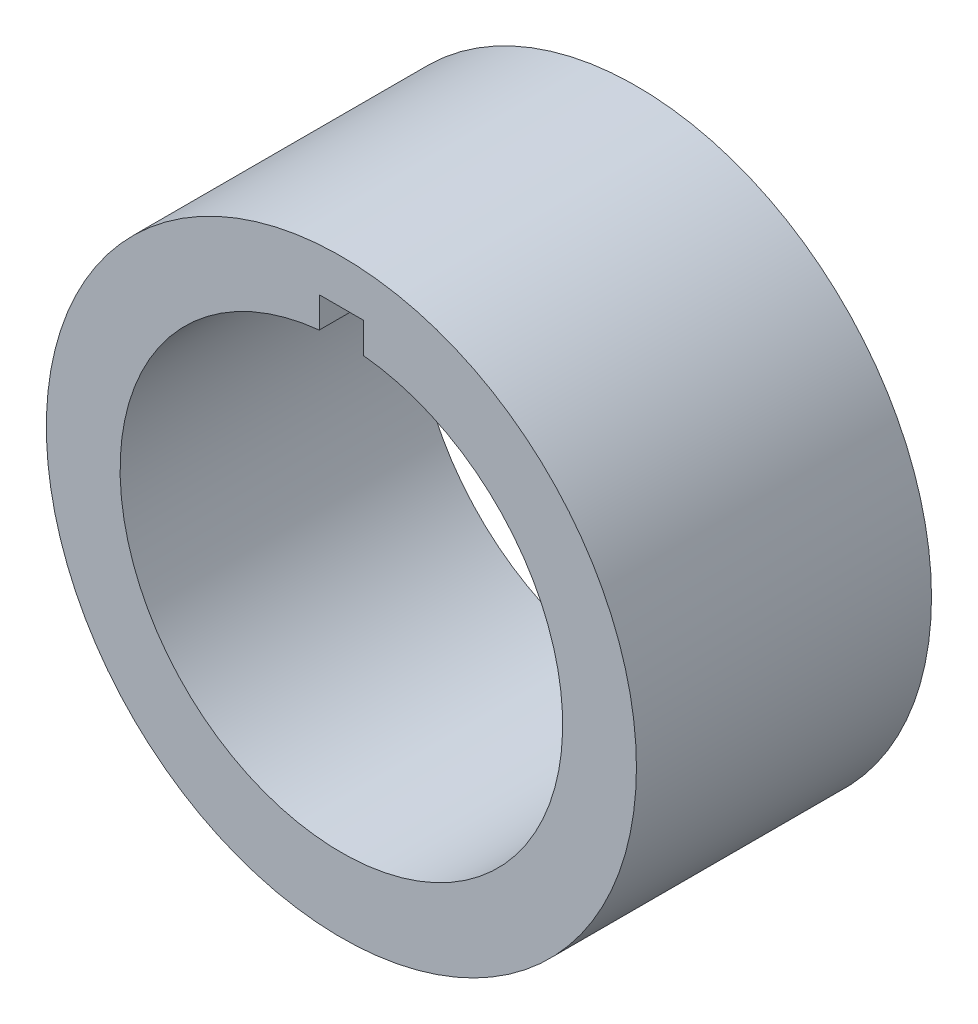
from build123d import *

# Parameters (mm, degrees)
SKETCH_1_R          = 20
EXTRUDE_1_DEPTH     = 20
SKETCH_2_R          = 15
SKETCH_2_W          = 3
SKETCH_2_H          = 17
CUT_EXTRUDE_1_DEPTH = 35.641016151


with BuildPart() as part:
    # 草图1 → 凸台-拉伸1 (new body)
    with BuildSketch(Plane.XY):
        Circle(SKETCH_1_R)
    extrude(amount=EXTRUDE_1_DEPTH)

    # 草图2 → 切除-拉伸1 (cut, through all)
    with BuildSketch(Plane.XY.offset(20)):
        Circle(SKETCH_2_R)
        with Locations((0, 8.5)):
            Rectangle(SKETCH_2_W, SKETCH_2_H)
    extrude(amount=-CUT_EXTRUDE_1_DEPTH, mode=Mode.SUBTRACT)


solid = part.part
